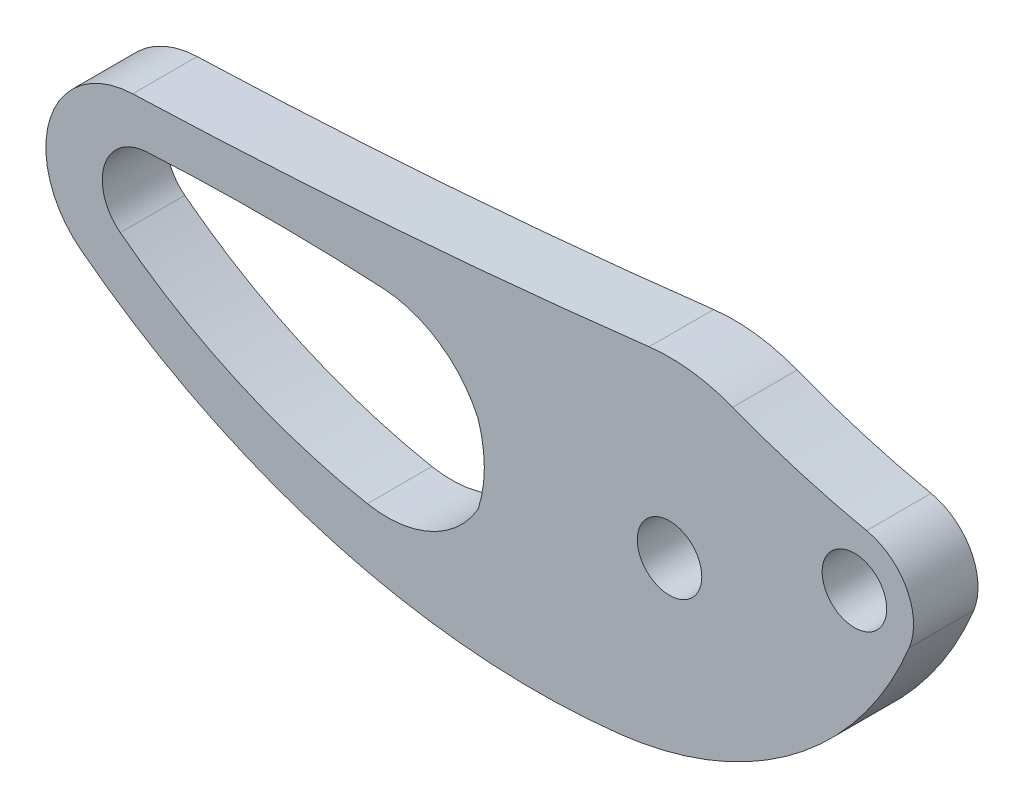
from build123d import *

# Parameters (mm, degrees)
ESQUISSE1_R        = 1.5
BOSS_EXTRU_1_DEPTH = 3


with BuildPart() as part:
    # Esquisse1 → Boss.-Extru.1 (new body)
    with BuildSketch(Plane.XY):
        with BuildLine():
            ThreePointArc((-27.380276014, -1.274350161), (-15.537335082, -7.194462147), (-2.33906069, -8.247329135))
            ThreePointArc((-2.33906069, -8.247329135), (5.804479886, -4.993281455), (11.147191658, 1.960962596))
            ThreePointArc((11.147191658, 1.960962596), (11.029757514, 4.289985461), (9.166322528, 5.692036935))
            ThreePointArc((9.166322528, 5.692036935), (6.013301366, 6.491366031), (2.936209941, 7.545869621))
            ThreePointArc((2.936209941, 7.545869621), (1.023768623, 8.032021848), (-0.949475558, 8.041142538))
            ThreePointArc((-0.949475558, 8.041142538), (-12.942714913, 6.878410061), (-24.974047874, 6.217528689))
            ThreePointArc((-24.974047874, 6.217528689), (-28.81213344, 3.317884658), (-27.380276014, -1.274350161))
        make_face()
        Circle(ESQUISSE1_R, mode=Mode.SUBTRACT)
        with Locations((8.6, 3)):
            Circle(ESQUISSE1_R, mode=Mode.SUBTRACT)
        with BuildLine():
            ThreePointArc((-25.549202237, 0.33835127), (-20.107029847, -2.924841196), (-14.056052845, -4.835689883))
            ThreePointArc((-14.056052845, -4.835689883), (-11.104571675, -4.479585719), (-8.90463517, -2.480003102))
            ThreePointArc((-8.90463517, -2.480003102), (-8.615705443, -0.657235742), (-8.90463517, 1.165531618))
            ThreePointArc((-8.90463517, 1.165531618), (-10.692993826, 3.307242171), (-13.334564289, 4.205716578))
            ThreePointArc((-13.334564289, 4.205716578), (-18.842020353, 4.354105802), (-24.349363894, 4.201597494))
            ThreePointArc((-24.349363894, 4.201597494), (-26.291680045, 2.686893023), (-25.549202237, 0.33835127))
        make_face(mode=Mode.SUBTRACT)
    extrude(amount=BOSS_EXTRU_1_DEPTH)


solid = part.part
